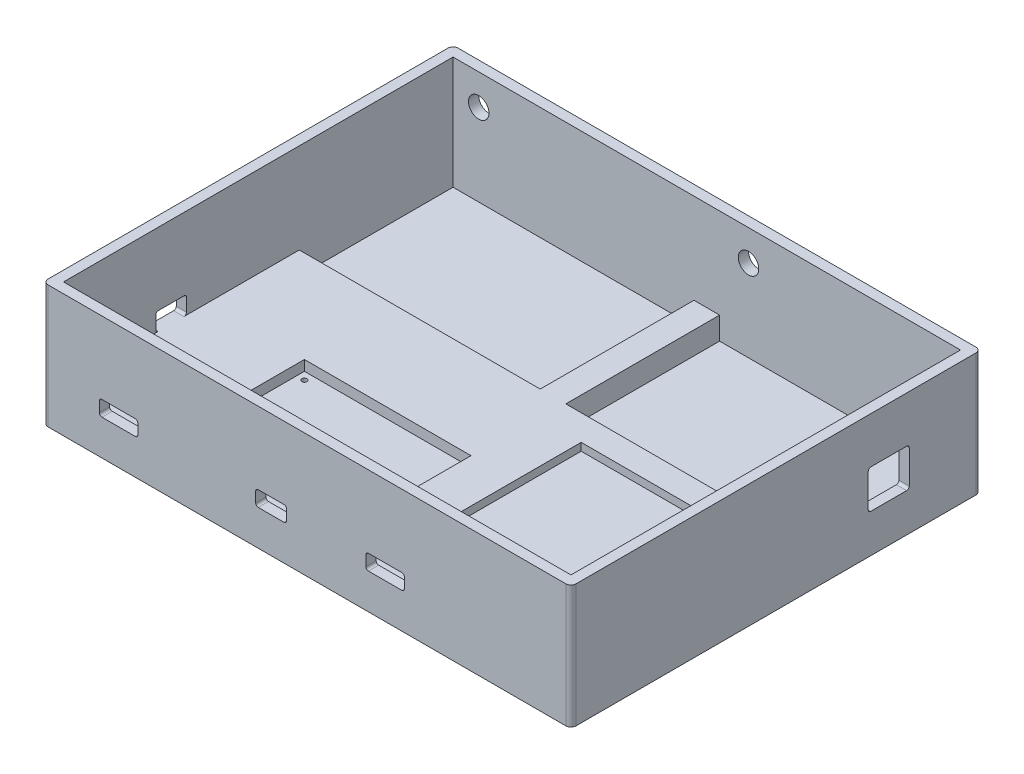
from build123d import *

# Parameters (mm, degrees)
SKETCH1_W           = 261.62
SKETCH1_H           = 203.2
BOSS_EXTRUDE1_DEPTH = 5.08
BOSS_EXTRUDE3_DEPTH = 55.88
BOSS_EXTRUDE4_DEPTH = 11.176
SKETCH7_W           = 251.46
SKETCH7_H           = 116.84
BOSS_EXTRUDE5_DEPTH = 11.176
SKETCH8_R           = 5.08
CUT_EXTRUDE2_DEPTH  = 11.176
CUT_EXTRUDE3_DEPTH  = 11.176
SKETCH10_W          = 82.55
SKETCH10_H          = 59.69
CUT_EXTRUDE4_DEPTH  = 5.08
SKETCH12_R          = 1.27
CUT_EXTRUDE5_DEPTH  = 8.89
SKETCH13_W          = 96.52
SKETCH13_H          = 66.04
CUT_EXTRUDE6_DEPTH  = 3.81
SKETCH14_W          = 251.46
SKETCH14_H          = 5.08
BOSS_EXTRUDE6_DEPTH = 44.704
CUT_EXTRUDE7_DEPTH  = 39.624
CUT_EXTRUDE8_DEPTH  = 39.624
CUT_EXTRUDE9_DEPTH  = 39.624
FILLET1_R           = 2.54


with BuildPart() as part:
    # Sketch1 → Boss-Extrude1 (new body)
    with BuildSketch(Plane(origin=(0, 0, 0), x_dir=(1, 0, 0), z_dir=(0, 1, 0))):
        with Locations((130.81, 101.6)):
            Rectangle(SKETCH1_W, SKETCH1_H)
    extrude(amount=BOSS_EXTRUDE1_DEPTH)

    # Sketch4 → Boss-Extrude3 (add)
    with BuildSketch(Plane(origin=(0, 5.08, 0), x_dir=(1, 0, 0), z_dir=(0, 1, 0))):
        Polygon((0, 0), (5.08, 0), (5.08, 198.12), (256.54, 198.12), (256.54, 0), (261.62, 0), (261.62, 203.2), (0, 203.2), align=None)
    extrude(amount=BOSS_EXTRUDE3_DEPTH)

    # Sketch5 → Boss-Extrude4 (add)
    with BuildSketch(Plane(origin=(0, 5.08, 0), x_dir=(1, 0, 0), z_dir=(0, 1, 0))):
        Polygon((5.08, 121.92), (124.46, 121.92), (124.46, 198.12), (137.16, 198.12), (137.16, 121.92), (256.54, 121.92), (256.54, 116.84), (5.08, 116.84), align=None)
    extrude(amount=BOSS_EXTRUDE4_DEPTH)

    # Sketch7 → Boss-Extrude5 (add)
    with BuildSketch(Plane(origin=(0, 5.08, 0), x_dir=(1, 0, 0), z_dir=(0, 1, 0))):
        with Locations((130.81, 58.42)):
            Rectangle(SKETCH7_W, SKETCH7_H)
    extrude(amount=BOSS_EXTRUDE5_DEPTH)

    # Sketch8 → Cut-Extrude2 (cut)
    with BuildSketch(Plane.XY.offset(-198.12)):
        with Locations((17.78, 45.72)):
            Circle(SKETCH8_R)
        with Locations((151.4856, 45.72)):
            Circle(SKETCH8_R)
    extrude(amount=-CUT_EXTRUDE2_DEPTH, mode=Mode.SUBTRACT)

    # Sketch9 → Cut-Extrude3 (cut)
    with BuildSketch(Plane(origin=(5.08, 0, 0), x_dir=(0, 0, -1), z_dir=(1, 0, 0))):
        with BuildLine():
            Line((52.07, 16.256), (64.77, 16.256))
            ThreePointArc((64.77, 16.256), (65.668025612, 16.627974388), (66.04, 17.526))
            Line((66.04, 17.526), (66.04, 23.876))
            ThreePointArc((66.04, 23.876), (65.668025612, 24.774025612), (64.77, 25.146))
            Line((64.77, 25.146), (52.07, 25.146))
            ThreePointArc((52.07, 25.146), (51.171974388, 24.774025612), (50.8, 23.876))
            Line((50.8, 23.876), (50.8, 17.526))
            ThreePointArc((50.8, 17.526), (51.171974388, 16.627974388), (52.07, 16.256))
        make_face()
    extrude(amount=-CUT_EXTRUDE3_DEPTH, mode=Mode.SUBTRACT)

    # Sketch10 → Cut-Extrude4 (cut)
    with BuildSketch(Plane(origin=(0, 16.256, 0), x_dir=(1, 0, 0), z_dir=(0, 1, 0))):
        with Locations((94.615, 46.355)):
            Rectangle(SKETCH10_W, SKETCH10_H)
    extrude(amount=-CUT_EXTRUDE4_DEPTH, mode=Mode.SUBTRACT)

    # Sketch12 → Cut-Extrude5 (cut)
    with BuildSketch(Plane(origin=(0, 11.176, 0), x_dir=(1, 0, 0), z_dir=(0, 1, 0))):
        with Locations(Location((57.15, 72.39, 0), (0, 0, 270))):
            Circle(SKETCH12_R)
        with Locations(Location((57.15, 20.32, 0), (0, 0, 270))):
            Circle(SKETCH12_R)
    extrude(amount=-CUT_EXTRUDE5_DEPTH, mode=Mode.SUBTRACT)

    # Sketch13 → Cut-Extrude6 (cut)
    with BuildSketch(Plane(origin=(0, 16.256, 0), x_dir=(1, 0, 0), z_dir=(0, 1, 0))):
        with Locations((205.74, 76.2)):
            Rectangle(SKETCH13_W, SKETCH13_H)
    extrude(amount=-CUT_EXTRUDE6_DEPTH, mode=Mode.SUBTRACT)

    # Sketch14 → Boss-Extrude6 (add)
    with BuildSketch(Plane(origin=(0, 16.256, 0), x_dir=(1, 0, 0), z_dir=(0, 1, 0))):
        with Locations((130.81, 2.54)):
            Rectangle(SKETCH14_W, SKETCH14_H)
    extrude(amount=BOSS_EXTRUDE6_DEPTH)

    # Sketch15 → Cut-Extrude7 (cut)
    with BuildSketch(Plane(origin=(0, 0, -5.08), x_dir=(-1, 0, 0), z_dir=(0, 0, -1))):
        with BuildLine():
            Line((-106.68, 17.526), (-119.38, 17.526))
            ThreePointArc((-119.38, 17.526), (-120.278025612, 17.897974388), (-120.65, 18.796))
            Line((-120.65, 18.796), (-120.65, 23.876))
            ThreePointArc((-120.65, 23.876), (-120.278025612, 24.774025612), (-119.38, 25.146))
            Line((-119.38, 25.146), (-106.68, 25.146))
            ThreePointArc((-106.68, 25.146), (-105.781974388, 24.774025612), (-105.41, 23.876))
            Line((-105.41, 23.876), (-105.41, 18.796))
            ThreePointArc((-105.41, 18.796), (-105.781974388, 17.897974388), (-106.68, 17.526))
        make_face()
    extrude(amount=-CUT_EXTRUDE7_DEPTH, mode=Mode.SUBTRACT)

    # Sketch16 → Cut-Extrude8 (cut)
    with BuildSketch(Plane.XY):
        with BuildLine():
            Line((161.29, 25.146), (177.8, 25.146))
            ThreePointArc((177.8, 25.146), (178.698025612, 24.774025612), (179.07, 23.876))
            Line((179.07, 23.876), (179.07, 18.796))
            ThreePointArc((179.07, 18.796), (178.698025612, 17.897974388), (177.8, 17.526))
            Line((177.8, 17.526), (161.29, 17.526))
            ThreePointArc((161.29, 17.526), (160.391974388, 17.897974388), (160.02, 18.796))
            Line((160.02, 18.796), (160.02, 23.876))
            ThreePointArc((160.02, 23.876), (160.391974388, 24.774025612), (161.29, 25.146))
        make_face()
        with BuildLine():
            Line((29.21, 25.146), (45.72, 25.146))
            ThreePointArc((45.72, 25.146), (46.618025612, 24.774025612), (46.99, 23.876))
            Line((46.99, 23.876), (46.99, 18.796))
            ThreePointArc((46.99, 18.796), (46.618025612, 17.897974388), (45.72, 17.526))
            Line((45.72, 17.526), (29.21, 17.526))
            ThreePointArc((29.21, 17.526), (28.311974388, 17.897974388), (27.94, 18.796))
            Line((27.94, 18.796), (27.94, 23.876))
            ThreePointArc((27.94, 23.876), (28.311974388, 24.774025612), (29.21, 25.146))
        make_face()
    extrude(amount=-CUT_EXTRUDE8_DEPTH, mode=Mode.SUBTRACT)

    # Sketch17 → Cut-Extrude9 (cut)
    with BuildSketch(Plane.ZY.offset(-256.54)):
        with BuildLine():
            Line((-166.37, 38.1), (-148.59, 38.1))
            ThreePointArc((-148.59, 38.1), (-147.691974388, 37.728025612), (-147.32, 36.83))
            Line((-147.32, 36.83), (-147.32, 20.32))
            ThreePointArc((-147.32, 20.32), (-147.691974388, 19.421974388), (-148.59, 19.05))
            Line((-148.59, 19.05), (-166.37, 19.05))
            ThreePointArc((-166.37, 19.05), (-167.268025612, 19.421974388), (-167.64, 20.32))
            Line((-167.64, 20.32), (-167.64, 36.83))
            ThreePointArc((-167.64, 36.83), (-167.268025612, 37.728025612), (-166.37, 38.1))
        make_face()
    extrude(amount=-CUT_EXTRUDE9_DEPTH, mode=Mode.SUBTRACT)

    # Fillet1
    fillet1_edges = [part.edges().sort_by_distance(p)[0] for p in [
        (0, 30.48, -203.2),
        (261.62, 30.48, -203.2),
        (261.62, 30.48, 0),
        (0, 30.48, 0),
    ]]
    fillet(fillet1_edges, radius=FILLET1_R)


solid = part.part
